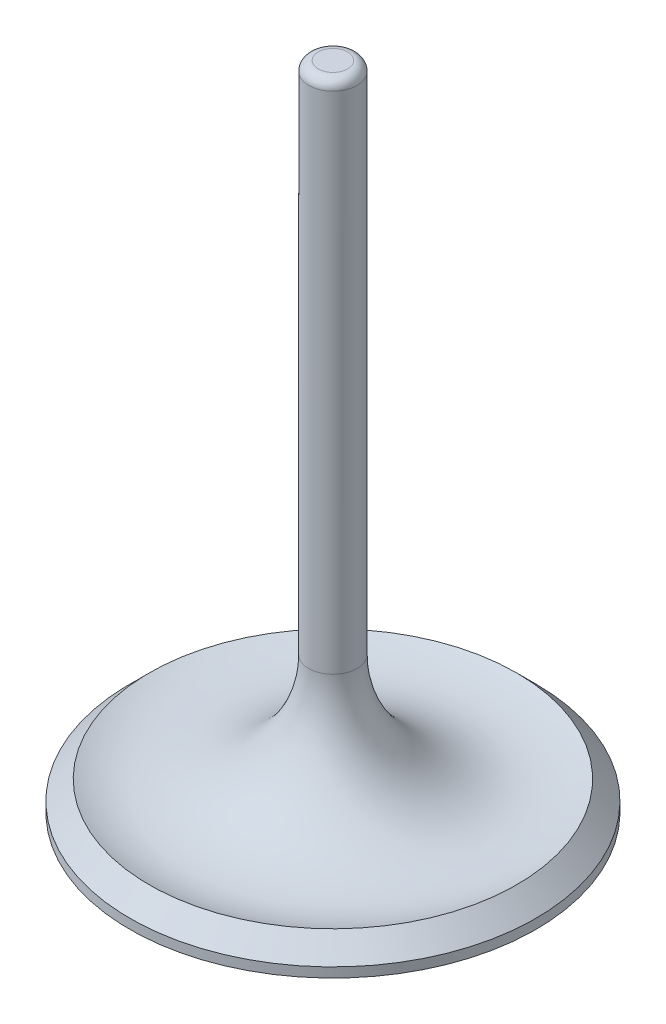
from build123d import *

# Parameters (mm, degrees)
FILLET1_R = 1.25


with BuildPart() as part:
    # Sketch1 → Revolve1 (revolve)
    with BuildSketch(Plane(origin=(0, 0, 0), x_dir=(0, 0, -1), z_dir=(1, 0, 0))):
        with BuildLine():
            Line((0, 0), (0, 85.55))
            Line((0, 85.55), (3.18, 85.55))
            Line((3.18, 85.55), (3.18, 17.954698654))
            ThreePointArc((3.18, 17.954698654), (9.896609701, 5.315721242), (24.13, 3.81))
            Line((24.13, 3.81), (26.67, 1.27))
            Line((26.67, 1.27), (26.67, 0))
            Line((26.67, 0), (0, 0))
        make_face()
    revolve(axis=Axis((0, 0, 0), (0, 1, 0)))

    # Fillet1
    fillet1_edges = [part.edges().sort_by_distance(p)[0] for p in [
        (0, 85.55, 3.18),
    ]]
    fillet(fillet1_edges, radius=FILLET1_R)


solid = part.part
